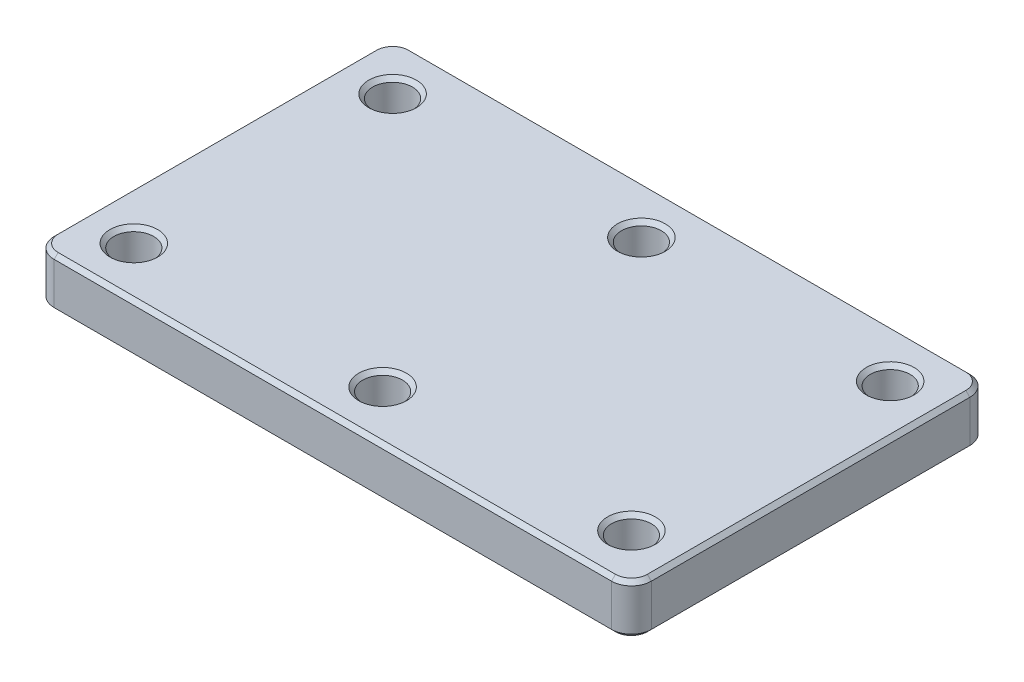
from build123d import *

# Parameters (mm, degrees)
SKETCH_1_W      = 300
SKETCH_1_H      = 180
EXTRUDE_1_DEPTH = 25
FILLET_1_R      = 10
SKETCH_2_R      = 10
EXTRUDE_2_DEPTH = 25
CHAMFER_1_SIZE  = 2


with BuildPart() as part:
    # 草圖1 → 擠出1 (new body)
    with BuildSketch(Plane(origin=(0, 0, 0), x_dir=(-1, 0, 0), z_dir=(0, 1, 0))):
        Rectangle(SKETCH_1_W, SKETCH_1_H)
    extrude(amount=EXTRUDE_1_DEPTH)

    # 圓角1
    fillet_1_edges = [part.edges().sort_by_distance(p)[0] for p in [
        (-150, 12.5, -90),
        (150, 12.5, -90),
        (150, 12.5, 90),
        (-150, 12.5, 90),
    ]]
    fillet(fillet_1_edges, radius=FILLET_1_R)

    # 草圖2 → 擠出2 (cut)
    with BuildSketch(Plane(origin=(0, 25, 0), x_dir=(-1, 0, 0), z_dir=(0, 1, 0))):
        with Locations(Location((-125, -65, 0), (0, 0, 90))):
            Circle(SKETCH_2_R)
        with Locations(Location((-125, 65, 0), (0, 0, 90))):
            Circle(SKETCH_2_R)
        with Locations(Location((0, 65, 0), (0, 0, 90))):
            Circle(SKETCH_2_R)
        with Locations(Location((0, -65, 0), (0, 0, 90))):
            Circle(SKETCH_2_R)
        with Locations(Location((125, -65, 0), (0, 0, 90))):
            Circle(SKETCH_2_R)
        with Locations(Location((125, 65, 0), (0, 0, 90))):
            Circle(SKETCH_2_R)
    extrude(amount=-EXTRUDE_2_DEPTH, mode=Mode.SUBTRACT)

    # 倒角1
    chamfer_1_edges = [part.edges().sort_by_distance(p)[0] for p in [
        (-150, 0, 0),
        (-150, 25, 0),
        (0, 0, -90),
        (150, 0, 0),
        (0, 0, 90),
        (147.071067812, 0, 87.071067812),
        (147.071067812, 0, -87.071067812),
        (-147.071067812, 0, 87.071067812),
        (-147.071067812, 0, -87.071067812),
        (0, 25, -90),
        (0, 25, 90),
        (150, 25, 0),
        (147.071067812, 25, 87.071067812),
        (147.071067812, 25, -87.071067812),
        (-147.071067812, 25, 87.071067812),
        (-147.071067812, 25, -87.071067812),
        (125, 0, 55),
        (125, 25, 55),
        (0, 0, 55),
        (0, 25, 55),
        (0, 0, -75),
        (0, 25, -75),
        (-125, 0, -75),
        (-125, 25, -75),
        (-125, 0, 55),
        (-125, 25, 55),
        (125, 0, -75),
        (125, 25, -75),
    ]]
    chamfer(chamfer_1_edges, length=CHAMFER_1_SIZE)


solid = part.part
